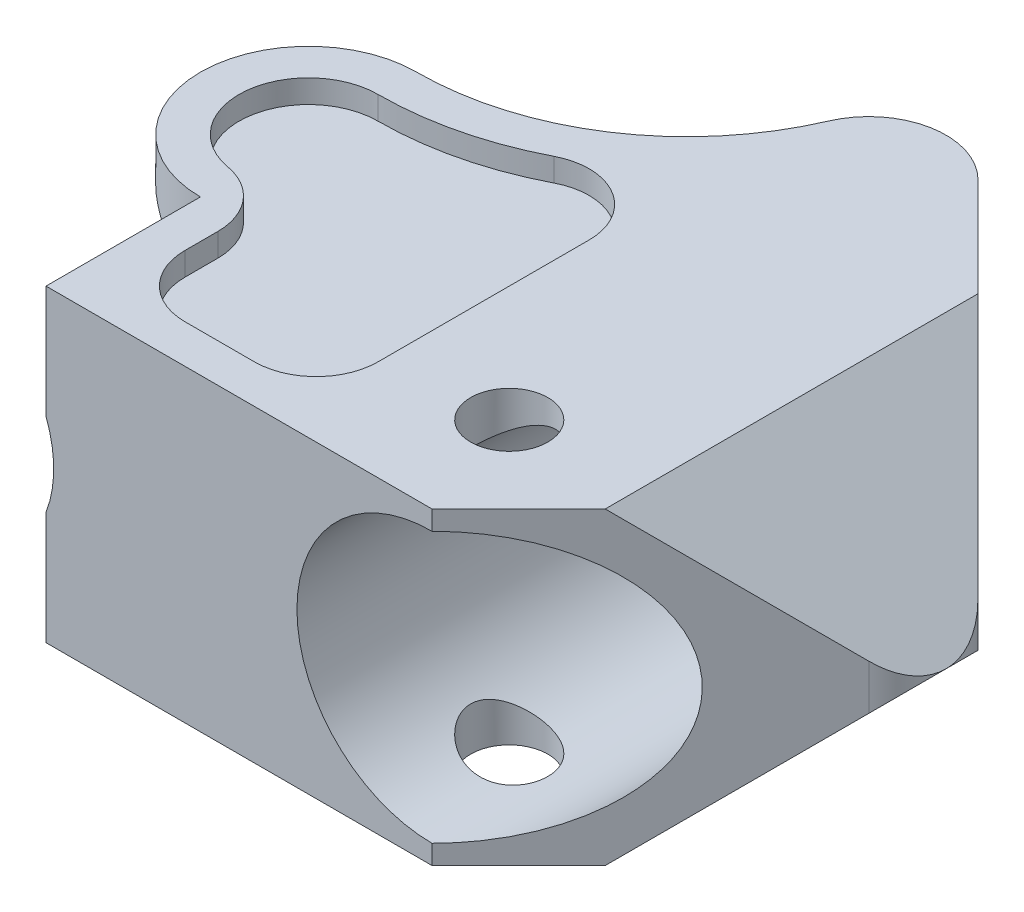
from build123d import *

# Parameters (mm, degrees)
BOSS_EXTRU_1_DEPTH      = 20
ENL_V_MAT_EXTRU_1_DEPTH = 3
ESQUISSE3_R             = 17.5
ESQUISSE3_R_2           = 15
ENL_V_MAT_EXTRU_2_DEPTH = 113.493063486
ESQUISSE5_R             = 5
ENL_V_MAT_EXTRU_3_DEPTH = 118.705944436
ENL_V_MAT_EXTRU_4_DEPTH = 113.493063571


with BuildPart() as part:
    # Esquisse1 → Boss.-Extru.1 (new, symmetric)
    with BuildSketch(Plane(origin=(0, 0, 0), x_dir=(1, 0, 0), z_dir=(0, 1, 0))):
        with BuildLine():
            Line((0, 0), (50, 0))
            Line((50, 0), (78.284271247, 28.284271247))
            ThreePointArc((78.284271247, 28.284271247), (81.213203436, 35.355339059), (78.284271247, 42.426406871))
            Line((78.284271247, 42.426406871), (48.412587767, 72.298090352))
            ThreePointArc((48.412587767, 72.298090352), (39.455979063, 75.047650602), (32.154515521, 69.176573087))
            ThreePointArc((32.154515521, 69.176573087), (19.250715026, 53.76970799), (0, 48))
            ThreePointArc((0, 48), (-14, 34), (0, 20))
            Line((0, 20), (0, 0))
        make_face()
    extrude(amount=BOSS_EXTRU_1_DEPTH, both=True)

    # Esquisse2 → Enlèv. mat.-Extru.1 (cut)
    with BuildSketch(Plane(origin=(0, 20, 0), x_dir=(1, 0, 0), z_dir=(0, 1, 0))):
        with BuildLine():
            Line((30, 40.338541985), (30, 13))
            ThreePointArc((30, 13), (27.656854249, 7.343145751), (22, 5))
            Line((22, 5), (13, 5))
            ThreePointArc((13, 5), (7.343145751, 7.343145751), (5, 13))
            Line((5, 13), (5, 17.266799469))
            ThreePointArc((5, 17.266799469), (3.135719911, 22.400311053), (-1.588235294, 25.141246778))
            ThreePointArc((-1.588235294, 25.141246778), (-8.964618759, 34.797251843), (0, 43))
            ThreePointArc((0, 43), (9.432693133, 44.128103979), (18.333333333, 47.448784987))
            ThreePointArc((18.333333333, 47.448784987), (26.163331999, 47.169842495), (30, 40.338541985))
        make_face()
    extrude(amount=-ENL_V_MAT_EXTRU_1_DEPTH, mode=Mode.SUBTRACT)

    # Esquisse3 → Enlèv. mat.-Extru.2 (cut, through all)
    with BuildSketch(Plane.XY):
        with Locations(Location((50, 0, 0), (0, 0, 270))):
            Circle(ESQUISSE3_R)
        with Locations((-14, 0)):
            Circle(ESQUISSE3_R_2)
    extrude(amount=-ENL_V_MAT_EXTRU_2_DEPTH, mode=Mode.SUBTRACT)

    # Esquisse5 → Enlèv. mat.-Extru.3 (cut, through all)
    with BuildSketch(Plane(origin=(0, 20, 0), x_dir=(1, 0, 0), z_dir=(0, 1, 0))):
        with Locations(Location((45, 15, 0), (0, 0, 270))):
            Circle(ESQUISSE5_R)
    extrude(amount=-ENL_V_MAT_EXTRU_3_DEPTH, mode=Mode.SUBTRACT)

    # Esquisse6 → Enlèv. mat.-Extru.4 (cut, through all)
    with BuildSketch(Plane.XY):
        Polygon((81.213203436, 0), (81.213203436, 20), (61.213203436, 20), align=None)
        Polygon((81.213203436, -20), (81.213203436, 0), (61.213203436, -20), align=None)
    extrude(amount=-ENL_V_MAT_EXTRU_4_DEPTH, mode=Mode.SUBTRACT)


solid = part.part
